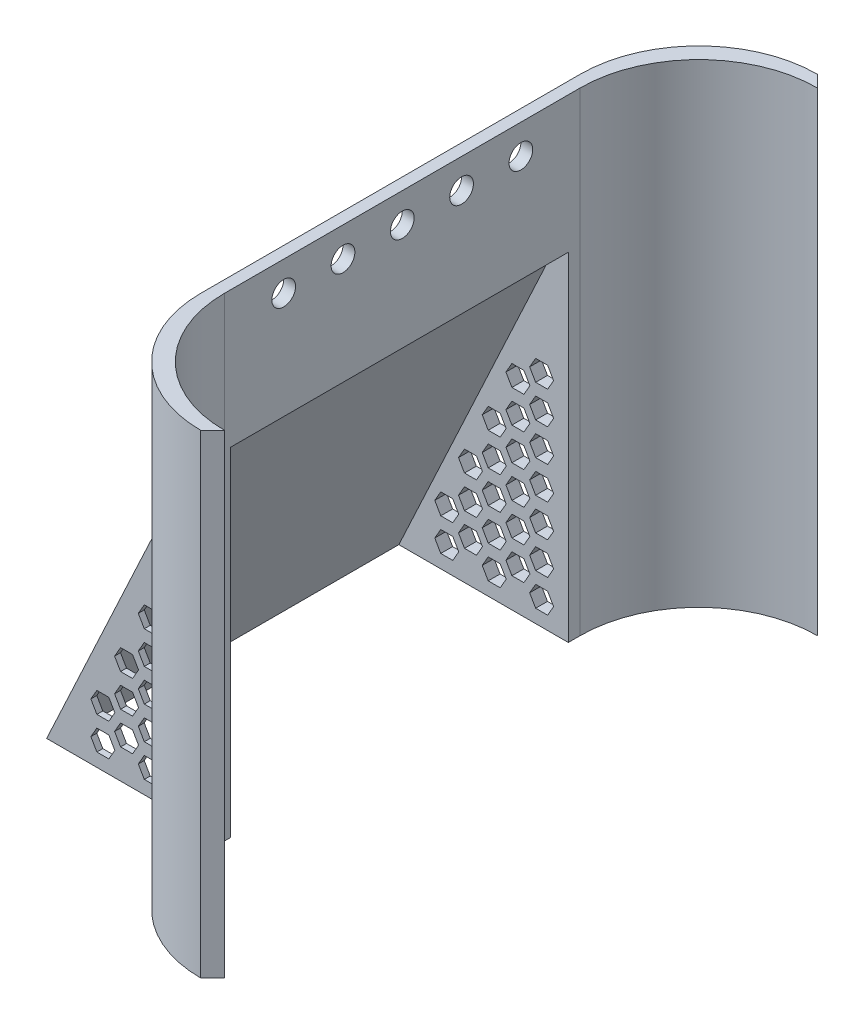
from build123d import *

# Parameters (mm, degrees)
Y_KSEKLIK_EKSTR_ZYON1_DEPTH = 80
IZIM9_R                     = 2
KES_EKSTR_ZYON1_DEPTH       = 3
IZIM11_W                    = 60
IZIM11_H                    = 60
KES_EKSTR_ZYON2_DEPTH       = 10
Y_KSEKLIK_EKSTR_ZYON2_DEPTH = 60
Y_KSEKLIK_EKSTR_ZYON6_DEPTH = 1
Y_KSEKLIK_EKSTR_ZYON7_DEPTH = 2
Y_KSEKLIK_EKSTR_ZYON8_DEPTH = 2
KES_EKSTR_ZYON3_DEPTH       = 86


with BuildPart() as part:
    # Çizim1 → Yükseklik-Ekstrüzyon1 (new body)
    with BuildSketch(Plane(origin=(0, 0, 0), x_dir=(1, 0, 0), z_dir=(0, 1, 0))):
        with BuildLine():
            Line((-23.491895264, 10.730676945), (-23.491895264, -49.269323055))
            ThreePointArc((-23.491895264, -49.269323055), (-17.634030888, -63.411458679), (-3.491895264, -69.269323055))
            Line((-3.491895264, -69.269323055), (-5.491895264, -71.269323055))
            ThreePointArc((-5.491895264, -71.269323055), (-19.634030888, -65.411458679), (-25.491895264, -51.269323055))
            Line((-25.491895264, -51.269323055), (-25.491895264, 12.730676945))
            ThreePointArc((-25.491895264, 12.730676945), (-19.634030888, 26.872812569), (-5.491895264, 32.730676945))
            Line((-5.491895264, 32.730676945), (-3.491895264, 30.730676945))
            ThreePointArc((-3.491895264, 30.730676945), (-17.634030888, 24.872812569), (-23.491895264, 10.730676945))
        make_face()
    extrude(amount=Y_KSEKLIK_EKSTR_ZYON1_DEPTH)

    # Çizim9 → Kes-Ekstrüzyon1 (cut)
    with BuildSketch(Plane(origin=(-23.491895264, 0, 0), x_dir=(0, 0, -1), z_dir=(1, 0, 0))):
        with Locations((-29.269323055, 75.020172502)):
            Circle(IZIM9_R)
        with Locations((-39.269323055, 75.020172502)):
            Circle(IZIM9_R)
        with Locations((-9.269323055, 75.020172502)):
            Circle(IZIM9_R)
        with Locations((0.730676945, 75.020172502)):
            Circle(IZIM9_R)
        with Locations((-19.269323055, 75.020172502)):
            Circle(IZIM9_R)
    extrude(amount=-KES_EKSTR_ZYON1_DEPTH, mode=Mode.SUBTRACT)

    # Çizim11 → Kes-Ekstrüzyon2 (cut)
    with BuildSketch(Plane.ZY.offset(25.491895264)):
        with Locations((19.269323055, 30)):
            Rectangle(IZIM11_W, IZIM11_H)
    extrude(amount=-KES_EKSTR_ZYON2_DEPTH, mode=Mode.SUBTRACT)



with BuildPart() as body_2:
    # Çizim13 → Yükseklik-Ekstrüzyon2 (new body)
    with BuildSketch(Plane.XY.offset(-10.730676945)):
        Polygon((-25.491895264, 60), (-53.470354754, 0), (-52.071431779, 0), (-25.491895264, 57), align=None)
    extrude(amount=Y_KSEKLIK_EKSTR_ZYON2_DEPTH)

    # Çizim14 → Yükseklik-Ekstrüzyon6 (add)
    with BuildSketch(Plane.XY.offset(49.269323055)):
        Polygon((-25.491895264, 0), (-53.470354754, 0), (-25.491895264, 60), align=None)
    extrude(amount=-Y_KSEKLIK_EKSTR_ZYON6_DEPTH)

    # Çizim16 → Yükseklik-Ekstrüzyon7 (add)
    with BuildSketch(Plane(origin=(0, 0, -10.730676945), x_dir=(-1, 0, 0), z_dir=(0, 0, -1))):
        Polygon((25.491895264, 60), (25.491895264, 0), (53.470354754, 0), align=None)
    extrude(amount=-Y_KSEKLIK_EKSTR_ZYON7_DEPTH)


with BuildPart() as part_1:
    add(part.part)

    add(body_2.part)  # Yükseklik-Ekstrüzyon8 merges body 2
    # Çizim17 → Yükseklik-Ekstrüzyon8 (add)
    with BuildSketch(Plane(origin=(-25.491895264, 0, 0), x_dir=(0, 0, -1), z_dir=(1, 0, 0))):
        Polygon((-48.269323055, 0), (-49.269323055, 0), (-49.269323055, 60), (10.730676945, 60), (10.730676945, 0), (8.730676945, 0), (8.730676945, 57), (-48.269323055, 57), align=None)
    extrude(amount=Y_KSEKLIK_EKSTR_ZYON8_DEPTH)

    # Çizim18 → Kes-Ekstrüzyon3 (cut)
    with BuildSketch(Plane.XY.offset(49.269323055)):
        Polygon((-26.981532293, 11.25), (-25.971169322, 9.5), (-26.981532293, 7.75), (-29.002258236, 7.75), (-30.012621207, 9.5), (-29.002258236, 11.25), align=None)
        Polygon((-25.971169322, 15), (-26.981532293, 16.75), (-29.002258236, 16.75), (-30.012621207, 15), (-29.002258236, 13.25), (-26.981532293, 13.25), align=None)
        Polygon((-25.971169322, 4), (-26.981532293, 5.75), (-29.002258236, 5.75), (-30.012621207, 4), (-29.002258236, 2.25), (-26.981532293, 2.25), align=None)
        Polygon((-26.981532293, 33.25), (-25.971169322, 31.5), (-26.981532293, 29.75), (-29.002258236, 29.75), (-30.012621207, 31.5), (-29.002258236, 33.25), align=None)
        Polygon((-26.981532293, 22.25), (-25.971169322, 20.5), (-26.981532293, 18.75), (-29.002258236, 18.75), (-30.012621207, 20.5), (-29.002258236, 22.25), align=None)
        Polygon((-25.971169322, 26), (-26.981532293, 27.75), (-29.002258236, 27.75), (-30.012621207, 26), (-29.002258236, 24.25), (-26.981532293, 24.25), align=None)
        Polygon((-25.971169322, 37), (-26.981532293, 38.75), (-29.002258236, 38.75), (-30.012621207, 37), (-29.002258236, 35.25), (-26.981532293, 35.25), align=None)
        Polygon((-30.981532293, 14), (-29.971169322, 12.25), (-30.981532293, 10.5), (-33.002258236, 10.5), (-34.012621207, 12.25), (-33.002258236, 14), align=None)
        Polygon((-29.971169322, 17.75), (-30.981532293, 19.5), (-33.002258236, 19.5), (-34.012621207, 17.75), (-33.002258236, 16), (-30.981532293, 16), align=None)
        Polygon((-29.971169322, 6.75), (-30.981532293, 8.5), (-33.002258236, 8.5), (-34.012621207, 6.75), (-33.002258236, 5), (-30.981532293, 5), align=None)
        Polygon((-30.981532293, 36), (-29.971169322, 34.25), (-30.981532293, 32.5), (-33.002258236, 32.5), (-34.012621207, 34.25), (-33.002258236, 36), align=None)
        Polygon((-30.981532293, 25), (-29.971169322, 23.25), (-30.981532293, 21.5), (-33.002258236, 21.5), (-34.012621207, 23.25), (-33.002258236, 25), align=None)
        Polygon((-29.971169322, 28.75), (-30.981532293, 30.5), (-33.002258236, 30.5), (-34.012621207, 28.75), (-33.002258236, 27), (-30.981532293, 27), align=None)
        Polygon((-37.002258236, 24.25), (-38.012621207, 26), (-37.002258236, 27.75), (-34.981532293, 27.75), (-33.971169322, 26), (-34.981532293, 24.25), align=None)
        Polygon((-41.002258236, 16), (-42.012621207, 17.75), (-41.002258236, 19.5), (-38.981532293, 19.5), (-37.971169322, 17.75), (-38.981532293, 16), align=None)
        Polygon((-37.002258236, 13.25), (-38.012621207, 15), (-37.002258236, 16.75), (-34.981532293, 16.75), (-33.971169322, 15), (-34.981532293, 13.25), align=None)
        Polygon((-38.012621207, 20.5), (-37.002258236, 18.75), (-34.981532293, 18.75), (-33.971169322, 20.5), (-34.981532293, 22.25), (-37.002258236, 22.25), align=None)
        Polygon((-38.012621207, 9.5), (-37.002258236, 7.75), (-34.981532293, 7.75), (-33.971169322, 9.5), (-34.981532293, 11.25), (-37.002258236, 11.25), align=None)
        Polygon((-37.002258236, 2.25), (-38.012621207, 4), (-37.002258236, 5.75), (-34.981532293, 5.75), (-33.971169322, 4), (-34.981532293, 2.25), align=None)
        Polygon((-42.012621207, 12.25), (-41.002258236, 10.5), (-38.981532293, 10.5), (-37.971169322, 12.25), (-38.981532293, 14), (-41.002258236, 14), align=None)
        Polygon((-41.002258236, 5), (-42.012621207, 6.75), (-41.002258236, 8.5), (-38.981532293, 8.5), (-37.971169322, 6.75), (-38.981532293, 5), align=None)
        Polygon((-42.981532293, 11.25), (-41.971169322, 9.5), (-42.981532293, 7.75), (-45.002258236, 7.75), (-46.012621207, 9.5), (-45.002258236, 11.25), align=None)
        Polygon((-41.971169322, 4), (-42.981532293, 5.75), (-45.002258236, 5.75), (-46.012621207, 4), (-45.002258236, 2.25), (-42.981532293, 2.25), align=None)
    extrude(amount=-KES_EKSTR_ZYON3_DEPTH, mode=Mode.SUBTRACT)


solid = part_1.part
